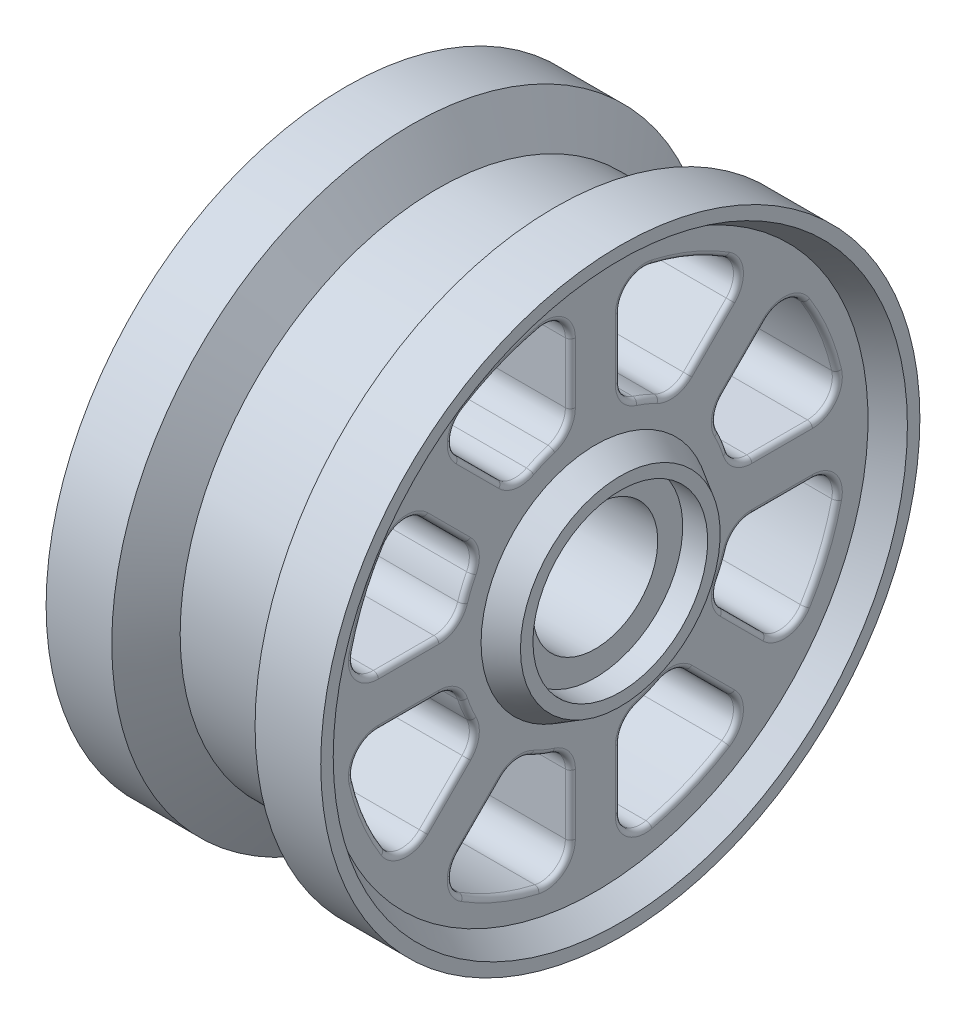
from build123d import *

# Parameters (mm, degrees)
CUT_EXTRUDE1_DEPTH = 4.5
CIRPATTERN1_COUNT  = 8
FILLET1_R          = 0.1


with BuildPart() as part:
    # Sketch1 → Revolve1 (revolve)
    with BuildSketch(Plane.XY, mode=Mode.PRIVATE) as revolve1_sk:
        Polygon((-0.915, 5.15), (0.915, 5.15), (1.435, 6), (2.75, 6), (2.75, 5.75), (2.25, 5.461324865), (2.25, 2.288675135), (2.75, 2), (2.75, 1.75), (2.25, 1.75), (2.25, 1.25), (-2.25, 1.25), (-2.25, 1.75), (-2.75, 1.75), (-2.75, 2), (-2.25, 2.288675135), (-2.25, 5.461324865), (-2.75, 5.75), (-2.75, 6), (-1.435, 6), align=None)
    revolve(revolve1_sk.sketch.rotate(Axis((0, 0, 0), (1, 0, 0)), 90), axis=Axis((0, 0, 0), (1, 0, 0)))

    # Sketch2 → Cut-Extrude1 (cut)
    with BuildSketch(Plane(origin=(2.25, 0, 0), x_dir=(0, 0, -1), z_dir=(1, 0, 0))):
        with BuildLine():
            Line((2.569626775, 1.862519994), (3.426955414, 2.719848633))
            ThreePointArc((3.426955414, 2.719848633), (3.836922847, 2.863102505), (4.204332662, 2.631574978))
            ThreePointArc((4.204332662, 2.631574978), (4.582442481, 1.898109825), (4.833716648, 1.112107623))
            ThreePointArc((4.833716648, 1.112107623), (4.737633361, 0.688594968), (4.346446825, 0.5))
            Line((4.346446825, 0.5), (3.134001036, 0.5))
            ThreePointArc((3.134001036, 0.5), (2.839039467, 0.596270297), (2.65766205, 0.848009308))
            ThreePointArc((2.65766205, 0.848009308), (2.577323759, 1.067562456), (2.47888399, 1.279617725))
            ThreePointArc((2.47888399, 1.279617725), (2.42913083, 1.585877289), (2.569626775, 1.862519994))
        make_face()
    cut_extrude1 = extrude(amount=-CUT_EXTRUDE1_DEPTH, mode=Mode.SUBTRACT)

    # CirPattern1: Cut-Extrude1 ×8 about axis
    cirpattern1_axis = Axis((0, 0, 0), (1, 0, 0))
    for i in range(1, CIRPATTERN1_COUNT):
        add(cut_extrude1.rotate(cirpattern1_axis, i * 360 / CIRPATTERN1_COUNT), mode=Mode.SUBTRACT)

    # Fillet1
    fillet1_edges = [part.edges().sort_by_distance(p)[0] for p in [
        (2.25, 1.898109825, -4.582442481),
        (2.25, 2.863102505, -3.836922847),
        (2.25, 2.291184314, -2.998291095),
        (2.25, 1.585877289, -2.42913083),
        (2.25, 1.067562456, -2.577323759),
        (2.25, 0.596270297, -2.839039467),
        (2.25, 0.5, -3.74022393),
        (2.25, 3.836922847, -2.863102505),
        (2.25, 4.582442481, -1.898109825),
        (2.25, 4.737633361, -0.688594968),
        (2.25, 3.74022393, -0.5),
        (2.25, 2.839039467, -0.596270297),
        (2.25, 2.577323759, -1.067562456),
        (2.25, 2.42913083, -1.585877289),
        (2.25, 2.998291095, -2.291184314),
        (2.25, 2.863102505, 3.836922847),
        (2.25, 1.898109825, 4.582442481),
        (2.25, 0.688594968, 4.737633361),
        (2.25, 0.5, 3.74022393),
        (2.25, 0.596270297, 2.839039467),
        (2.25, 1.067562456, 2.577323759),
        (2.25, 1.585877289, 2.42913083),
        (2.25, 2.291184314, 2.998291095),
        (2.25, 4.737633361, 0.688594968),
        (2.25, 4.582442481, 1.898109825),
        (2.25, 3.836922847, 2.863102505),
        (2.25, 2.998291095, 2.291184314),
        (2.25, 2.577323759, 1.067562456),
        (2.25, 2.839039467, 0.596270297),
        (2.25, 3.74022393, 0.5),
        (-2.25, 1.585877289, -2.42913083),
        (-2.25, 2.291184314, -2.998291095),
        (-2.25, 2.863102505, -3.836922847),
        (-2.25, 1.898109825, -4.582442481),
        (-2.25, 0.688594968, -4.737633361),
        (-2.25, 0.5, -3.74022393),
        (-2.25, 0.596270297, -2.839039467),
        (-2.25, 1.067562456, -2.577323759),
        (-2.25, -0.596270297, -2.839039467),
        (-2.25, -0.5, -3.74022393),
        (-2.25, -0.688594968, -4.737633361),
        (-2.25, -1.898109825, -4.582442481),
        (-2.25, -2.863102505, -3.836922847),
        (-2.25, -2.291184314, -2.998291095),
        (-2.25, -1.585877289, -2.42913083),
        (-2.25, -1.067562456, -2.577323759),
        (-2.25, 2.839039467, -0.596270297),
        (-2.25, 3.74022393, -0.5),
        (-2.25, 4.737633361, -0.688594968),
        (-2.25, 4.582442481, -1.898109825),
        (-2.25, 3.836922847, -2.863102505),
        (-2.25, 2.998291095, -2.291184314),
        (-2.25, 2.42913083, -1.585877289),
        (-2.25, 2.42913083, 1.585877289),
        (-2.25, 3.836922847, 2.863102505),
        (-2.25, 4.582442481, 1.898109825),
        (-2.25, 4.737633361, 0.688594968),
        (-2.25, 3.74022393, 0.5),
        (-2.25, 2.839039467, 0.596270297),
        (-2.25, 2.577323759, 1.067562456),
        (-2.25, -2.42913083, -1.585877289),
        (-2.25, -2.998291095, -2.291184314),
        (-2.25, -4.582442481, -1.898109825),
        (-2.25, -4.737633361, -0.688594968),
        (-2.25, -3.74022393, -0.5),
        (-2.25, -2.839039467, -0.596270297),
        (-2.25, -2.577323759, -1.067562456),
        (-2.25, -2.839039467, 0.596270297),
        (-2.25, -4.582442481, 1.898109825),
        (-2.25, -3.836922847, 2.863102505),
        (-2.25, -2.998291095, 2.291184314),
        (-2.25, -2.42913083, 1.585877289),
        (-2.25, -2.577323759, 1.067562456),
        (-2.25, -1.585877289, 2.42913083),
        (-2.25, -2.291184314, 2.998291095),
        (-2.25, -2.863102505, 3.836922847),
        (-2.25, -1.898109825, 4.582442481),
        (-2.25, -0.5, 3.74022393),
        (-2.25, -0.596270297, 2.839039467),
        (-2.25, -1.067562456, 2.577323759),
        (-2.25, 0.596270297, 2.839039467),
        (-2.25, 0.5, 3.74022393),
        (-2.25, 0.688594968, 4.737633361),
        (-2.25, 1.898109825, 4.582442481),
        (-2.25, 2.863102505, 3.836922847),
        (-2.25, 2.291184314, 2.998291095),
        (-2.25, 1.585877289, 2.42913083),
        (-2.25, 1.067562456, 2.577323759),
        (2.25, -2.863102505, -3.836922847),
        (2.25, -2.291184314, -2.998291095),
        (2.25, -1.585877289, -2.42913083),
        (2.25, -1.067562456, -2.577323759),
        (2.25, -0.596270297, -2.839039467),
        (2.25, -0.5, -3.74022393),
        (2.25, -4.582442481, -1.898109825),
        (2.25, -4.737633361, -0.688594968),
        (2.25, -3.74022393, -0.5),
        (2.25, -2.839039467, -0.596270297),
        (2.25, -2.577323759, -1.067562456),
        (2.25, -2.42913083, -1.585877289),
        (2.25, -2.998291095, -2.291184314),
        (2.25, -4.582442481, 1.898109825),
        (2.25, -3.836922847, 2.863102505),
        (2.25, -2.998291095, 2.291184314),
        (2.25, -2.42913083, 1.585877289),
        (2.25, -2.577323759, 1.067562456),
        (2.25, -2.839039467, 0.596270297),
        (2.25, -3.74022393, 0.5),
        (2.25, -1.067562456, 2.577323759),
        (2.25, -1.585877289, 2.42913083),
        (2.25, -2.291184314, 2.998291095),
        (2.25, -2.863102505, 3.836922847),
        (2.25, -1.898109825, 4.582442481),
        (2.25, -0.688594968, 4.737633361),
        (2.25, -0.5, 3.74022393),
        (2.25, -0.688594968, -4.737633361),
        (2.25, -3.836922847, -2.863102505),
        (2.25, -4.737633361, 0.688594968),
        (2.25, -0.596270297, 2.839039467),
    ]]
    fillet(fillet1_edges, radius=FILLET1_R)


solid = part.part
